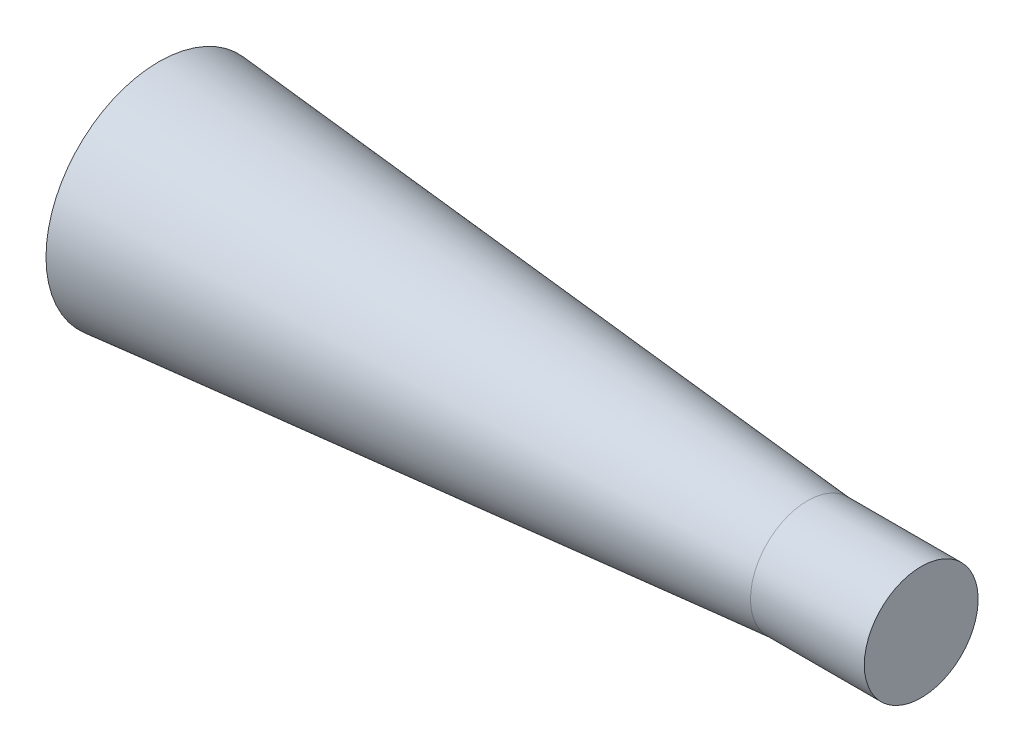
from build123d import *


with BuildPart() as part:
    # Sketch1 → Revolve1 (revolve)
    with BuildSketch(Plane.XY, mode=Mode.PRIVATE) as revolve1_sk:
        with BuildLine():
            Line((34, 2.5), (29, 2.5))
            Line((29, 2.5), (0.5, 4.956896552))
            ThreePointArc((0.5, 4.956896552), (0.125316351, 2.491025061), (0, 0))
            Line((0, 0), (34, 0))
            Line((34, 0), (34, 2.5))
        make_face()
    revolve(revolve1_sk.sketch.rotate(Axis((0, 0, 0), (1, 0, 0)), 90), axis=Axis((0, 0, 0), (1, 0, 0)))


solid = part.part
